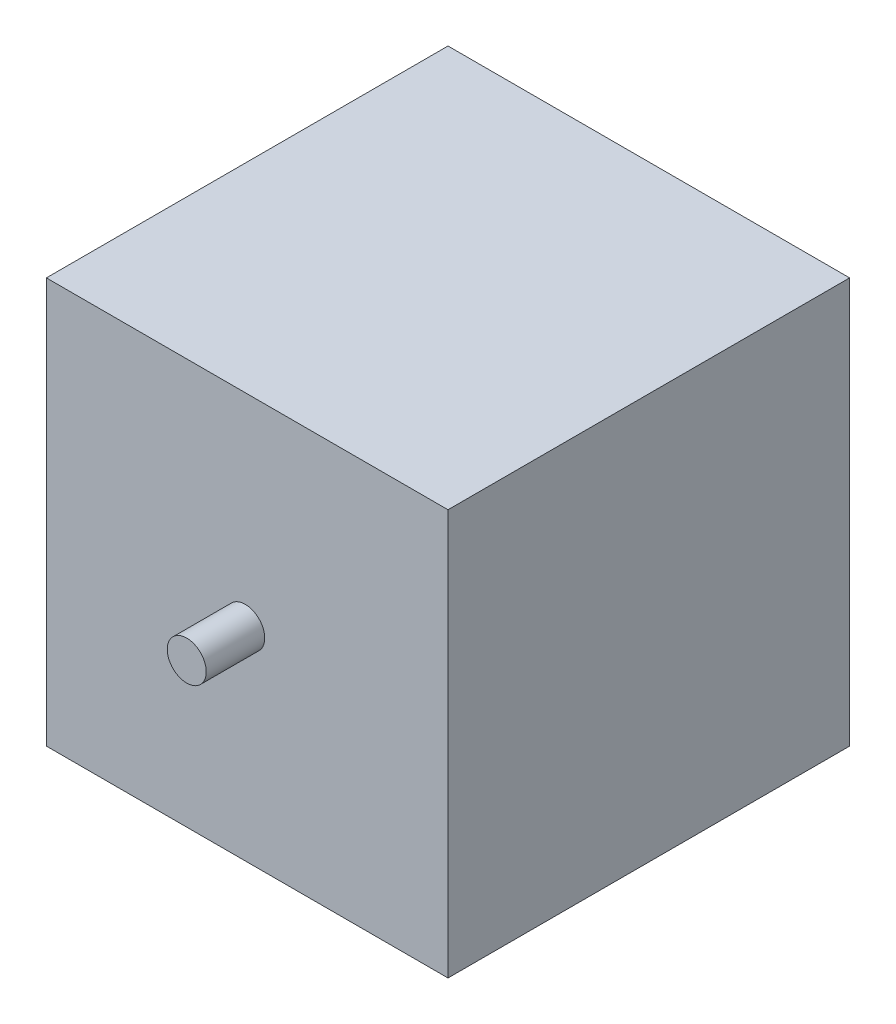
from build123d import *

# Parameters (mm, degrees)
SKETCH1_W           = 103
SKETCH1_H           = 103
BOSS_EXTRUDE1_DEPTH = 104
SKETCH2_R           = 5
BOSS_EXTRUDE2_DEPTH = 15
BOSS_EXTRUDE3_START = 15
SKETCH3_R           = 5
BOSS_EXTRUDE3_DEPTH = 15
SKETCH4_R           = 17.5
SKETCH4_R_2         = 12.5
CUT_EXTRUDE1_DEPTH  = 20


with BuildPart() as part:
    # Sketch1 → Boss-Extrude1 (new body)
    with BuildSketch(Plane(origin=(0, 0, 0), x_dir=(1, 0, 0), z_dir=(0, 1, 0))):
        Rectangle(SKETCH1_W, SKETCH1_H)
    extrude(amount=BOSS_EXTRUDE1_DEPTH)

    # Sketch2 → Boss-Extrude2 (add)
    with BuildSketch(Plane.XY.offset(51.5)):
        with Locations(Location((-0.5, 51.997596098, 0), (0, 0, 180))):
            Circle(SKETCH2_R)
    extrude(amount=BOSS_EXTRUDE2_DEPTH)

    # Sketch3 → Boss-Extrude3 (add)
    with BuildSketch(Plane(origin=(0, 0, -51.5), x_dir=(-1, 0, 0), z_dir=(0, 0, -1)).offset(BOSS_EXTRUDE3_START)):
        with Locations((0.5, 51.997596098)):
            Circle(SKETCH3_R)
    extrude(amount=-BOSS_EXTRUDE3_DEPTH)

    # Sketch4 → Cut-Extrude1 (cut)
    with BuildSketch(Plane.ZY.offset(51.5)):
        with Locations((0, 52)):
            Circle(SKETCH4_R)
        with Locations((0, 52)):
            Circle(SKETCH4_R_2, mode=Mode.SUBTRACT)
    extrude(amount=-CUT_EXTRUDE1_DEPTH, mode=Mode.SUBTRACT)


solid = part.part
